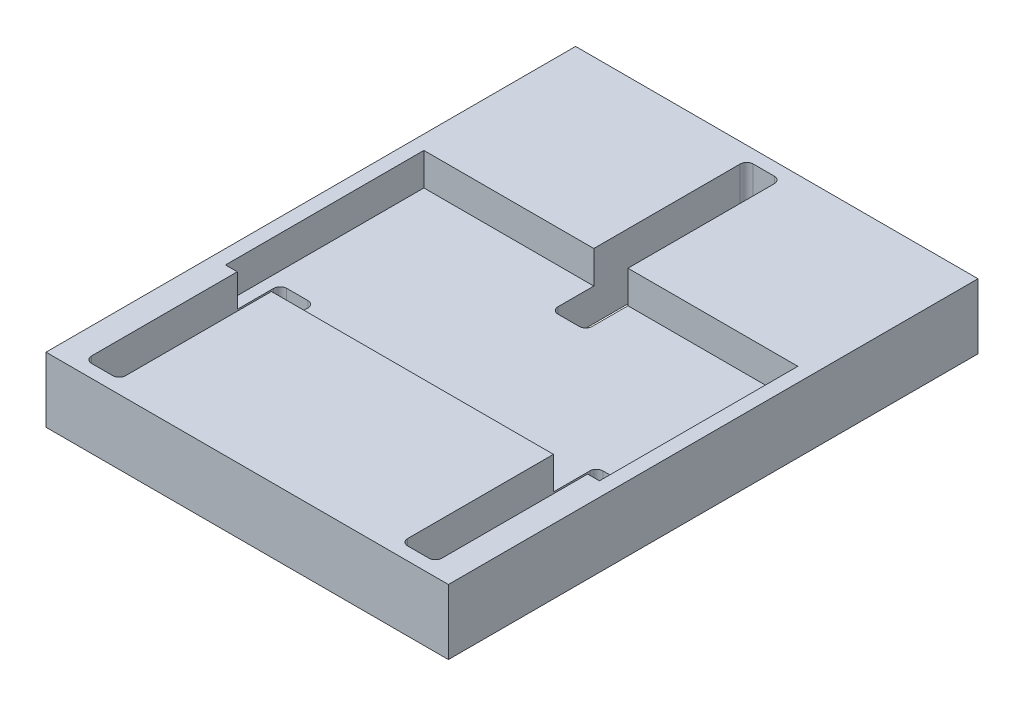
from build123d import *

# Parameters (mm, degrees)
BOSS_EXTRUDE5_DEPTH   = 10
CUT_EXTRUDE6_DEPTH    = 5
FILLET4_R             = 1
FILLET4_OF_MIRROR25_R = 1


with BuildPart() as part:
    # Sketch15 → Boss-Extrude5 (new body)
    with BuildSketch(Plane(origin=(0, 0, 0), x_dir=(1, 0, 0), z_dir=(0, 1, 0))):
        Polygon((24.3, 76.900659127), (-6.625, 76.900659127), (-6.625, -4.5), (24.3, -4.5), (24.3, 44.900659127), (21.675, 44.900659127), (21.675, 47.400659127), (21.675, 72.400659127), (21.675, 74.900659127), (24.3, 74.900659127), align=None)
        Polygon((-2.625, 25), (-2.625, 0), (-2.625, -2.5), (0, -2.5), (2.625, -2.5), (2.625, 0), (2.625, 25), (2.625, 27.5), (0, 27.5), (-2.625, 27.5), align=None, mode=Mode.SUBTRACT)
    boss_extrude5 = extrude(amount=BOSS_EXTRUDE5_DEPTH)

    # Sketch18 → Cut-Extrude6 (cut)
    with BuildSketch(Plane(origin=(0, 10, 0), x_dir=(1, 0, 0), z_dir=(0, 1, 0))):
        Polygon((21.675, 51.3980649), (-4.44053483, 51.3980649), (-4.44053483, 20.8980649), (24.3, 20.8980649), (24.3, 51.3980649), align=None)
    cut_extrude6 = extrude(amount=-CUT_EXTRUDE6_DEPTH, mode=Mode.SUBTRACT)

    # Fillet4
    fillet4_edges = [part.edges().sort_by_distance(p)[0] for p in [
        (21.675, 5, -74.900659127),
        (-2.625, 5, 2.5),
        (2.625, 5, 2.5),
        (2.625, 2.5, -27.5),
        (-2.625, 2.5, -27.5),
        (21.675, 2.5, -44.900659127),
    ]]
    fillet(fillet4_edges, radius=FILLET4_R)

    # Mirror25: Boss-Extrude5, Cut-Extrude6 across plane
    add(boss_extrude5.mirror(Plane(origin=(24.3, 10, 4.5), x_dir=(0, 0, 1), z_dir=(-1, 0, 0))))
    add(cut_extrude6.mirror(Plane(origin=(24.3, 10, 4.5), x_dir=(0, 0, 1), z_dir=(-1, 0, 0))), mode=Mode.SUBTRACT)

    # Fillet4 of Mirror25
    fillet4_of_mirror25_edges = [part.edges().sort_by_distance(p)[0] for p in [
        (26.925, 5, -74.900659127),
        (51.225, 5, 2.5),
        (45.975, 5, 2.5),
        (45.975, 2.5, -27.5),
        (51.225, 2.5, -27.5),
        (26.925, 2.5, -44.900659127),
    ]]
    fillet(fillet4_of_mirror25_edges, radius=FILLET4_OF_MIRROR25_R)


solid = part.part
